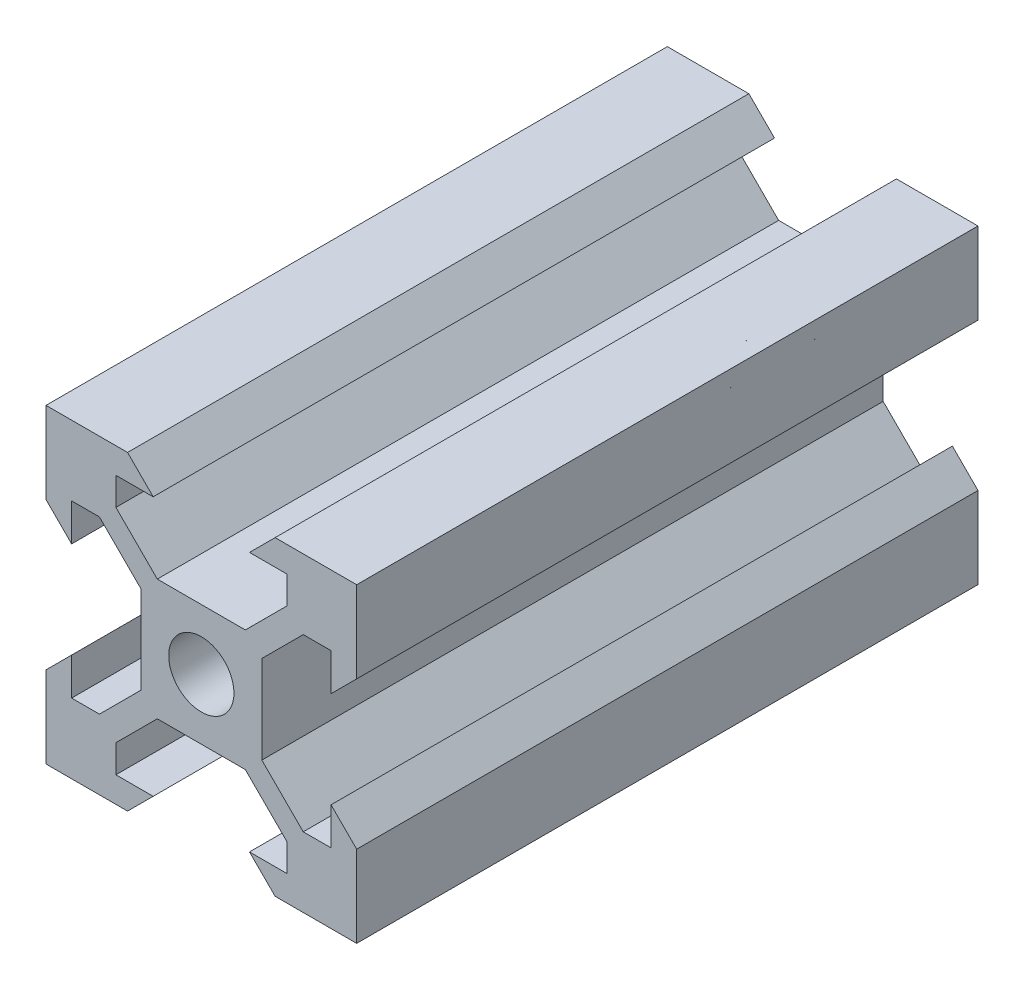
from build123d import *

# Parameters (mm, degrees)
SKETCH1_R           = 2.1
BOSS_EXTRUDE1_DEPTH = 20


with BuildPart() as part:
    # Sketch1 → Boss-Extrude1 (new, symmetric)
    with BuildSketch(Plane.XY):
        Polygon((2.834320347, 3.893970342), (5.5, 6.558849663), (5.5, 8.349069506), (3.1, 8.349069506), (4.75, 9.998574117), (10, 9.998574117), (10, 4.746997406), (8.35, 3.097492795), (8.350720674, 5.497492687), (6.560500912, 5.498030255), (3.894821259, 2.833150935), (3.894821259, -2.833150935), (6.560500912, -5.498030255), (8.350720674, -5.497492687), (8.35, -3.097492795), (10, -4.746997406), (10, -9.998574117), (4.75, -9.998574117), (3.1, -8.349069506), (5.5, -8.349069506), (5.5, -6.558849663), (2.834320347, -3.893970342), (-2.834320347, -3.893970342), (-5.5, -6.558849663), (-5.5, -8.349069506), (-3.1, -8.349069506), (-4.75, -9.998574117), (-10, -9.998574117), (-10, -4.746997406), (-8.35, -3.097492795), (-8.350720674, -5.497492687), (-6.560500912, -5.498030255), (-3.894821259, -2.833150935), (-3.894821259, 2.833150935), (-6.560500912, 5.498030255), (-8.350720674, 5.497492687), (-8.35, 3.097492795), (-10, 4.746997406), (-10, 9.998574117), (-4.75, 9.998574117), (-3.1, 8.349069506), (-5.5, 8.349069506), (-5.5, 6.558849663), (-2.834320347, 3.893970342), align=None)
        Circle(SKETCH1_R, mode=Mode.SUBTRACT)
    extrude(amount=BOSS_EXTRUDE1_DEPTH, both=True)


solid = part.part
